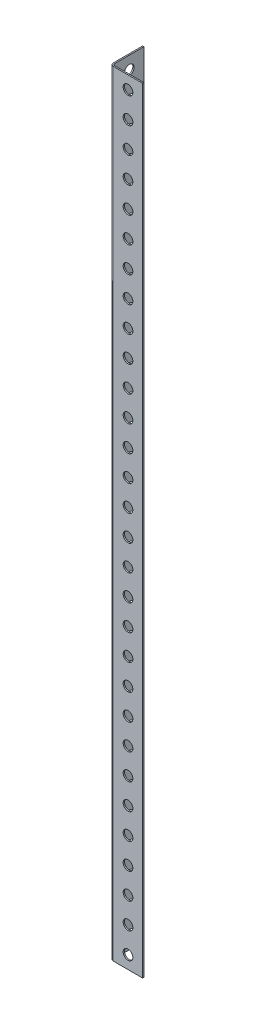
from build123d import *

# Parameters (mm, degrees)
BOSS_EXTRUDE1_DEPTH = 1219.2
SKETCH3_R           = 4.7625
CUT_EXTRUDE1_DEPTH  = 1.27
SKETCH4_R           = 4.7625
CUT_EXTRUDE2_DEPTH  = 1.27
FILLET1_R           = 3.175
FILLET2_R           = 1.5875
CUT_EXTRUDE3_DEPTH  = 457.2


with BuildPart() as part:
    # Sketch1 → Boss-Extrude1 (new body)
    with BuildSketch(Plane(origin=(0, 0, 0), x_dir=(1, 0, 0), z_dir=(0, 1, 0))):
        Polygon((1.27, 1.27), (1.27, 30.48), (1.27, 31.75), (0, 31.75), (0, 0), (31.75, 0), (31.75, 1.27), (30.48, 1.27), align=None)
    extrude(amount=BOSS_EXTRUDE1_DEPTH)

    # Sketch3 → Cut-Extrude1 (cut)
    with BuildSketch(Plane.ZY):
        with Locations((-17.4625, 12.7)):
            Circle(SKETCH3_R)
        with Locations((-17.4625, 38.1)):
            Circle(SKETCH3_R)
        with Locations((-17.4625, 63.5)):
            Circle(SKETCH3_R)
        with Locations((-17.4625, 88.9)):
            Circle(SKETCH3_R)
        with Locations((-17.4625, 114.3)):
            Circle(SKETCH3_R)
        with Locations((-17.4625, 139.7)):
            Circle(SKETCH3_R)
        with Locations((-17.4625, 165.1)):
            Circle(SKETCH3_R)
        with Locations((-17.4625, 190.5)):
            Circle(SKETCH3_R)
        with Locations((-17.4625, 215.9)):
            Circle(SKETCH3_R)
        with Locations((-17.4625, 241.3)):
            Circle(SKETCH3_R)
        with Locations((-17.4625, 266.7)):
            Circle(SKETCH3_R)
        with Locations((-17.4625, 292.1)):
            Circle(SKETCH3_R)
        with Locations((-17.4625, 317.5)):
            Circle(SKETCH3_R)
        with Locations((-17.4625, 342.9)):
            Circle(SKETCH3_R)
        with Locations((-17.4625, 368.3)):
            Circle(SKETCH3_R)
        with Locations((-17.4625, 393.7)):
            Circle(SKETCH3_R)
        with Locations((-17.4625, 419.1)):
            Circle(SKETCH3_R)
        with Locations((-17.4625, 444.5)):
            Circle(SKETCH3_R)
        with Locations((-17.4625, 469.9)):
            Circle(SKETCH3_R)
        with Locations((-17.4625, 495.3)):
            Circle(SKETCH3_R)
        with Locations((-17.4625, 520.7)):
            Circle(SKETCH3_R)
        with Locations((-17.4625, 546.1)):
            Circle(SKETCH3_R)
        with Locations((-17.4625, 571.5)):
            Circle(SKETCH3_R)
        with Locations((-17.4625, 596.9)):
            Circle(SKETCH3_R)
        with Locations((-17.4625, 622.3)):
            Circle(SKETCH3_R)
        with Locations((-17.4625, 647.7)):
            Circle(SKETCH3_R)
        with Locations((-17.4625, 673.1)):
            Circle(SKETCH3_R)
        with Locations((-17.4625, 698.5)):
            Circle(SKETCH3_R)
        with Locations((-17.4625, 723.9)):
            Circle(SKETCH3_R)
        with Locations((-17.4625, 749.3)):
            Circle(SKETCH3_R)
        with Locations((-17.4625, 774.7)):
            Circle(SKETCH3_R)
        with Locations((-17.4625, 800.1)):
            Circle(SKETCH3_R)
        with Locations((-17.4625, 825.5)):
            Circle(SKETCH3_R)
        with Locations((-17.4625, 850.9)):
            Circle(SKETCH3_R)
        with Locations((-17.4625, 876.3)):
            Circle(SKETCH3_R)
        with Locations((-17.4625, 901.7)):
            Circle(SKETCH3_R)
        with Locations((-17.4625, 927.1)):
            Circle(SKETCH3_R)
        with Locations((-17.4625, 952.5)):
            Circle(SKETCH3_R)
        with Locations((-17.4625, 977.9)):
            Circle(SKETCH3_R)
        with Locations((-17.4625, 1003.3)):
            Circle(SKETCH3_R)
        with Locations((-17.4625, 1028.7)):
            Circle(SKETCH3_R)
        with Locations((-17.4625, 1054.1)):
            Circle(SKETCH3_R)
        with Locations((-17.4625, 1079.5)):
            Circle(SKETCH3_R)
        with Locations((-17.4625, 1104.9)):
            Circle(SKETCH3_R)
        with Locations((-17.4625, 1130.3)):
            Circle(SKETCH3_R)
        with Locations((-17.4625, 1155.7)):
            Circle(SKETCH3_R)
        with Locations((-17.4625, 1181.1)):
            Circle(SKETCH3_R)
        with Locations((-17.4625, 1206.5)):
            Circle(SKETCH3_R)
    extrude(amount=-CUT_EXTRUDE1_DEPTH, mode=Mode.SUBTRACT)

    # Sketch4 → Cut-Extrude2 (cut)
    with BuildSketch(Plane.XY):
        with Locations((17.4625, 1206.5)):
            Circle(SKETCH4_R)
        with Locations((17.4625, 1181.1)):
            Circle(SKETCH4_R)
        with Locations((17.4625, 1155.7)):
            Circle(SKETCH4_R)
        with Locations((17.4625, 1130.3)):
            Circle(SKETCH4_R)
        with Locations((17.4625, 1104.9)):
            Circle(SKETCH4_R)
        with Locations((17.4625, 1079.5)):
            Circle(SKETCH4_R)
        with Locations((17.4625, 1054.1)):
            Circle(SKETCH4_R)
        with Locations((17.4625, 1028.7)):
            Circle(SKETCH4_R)
        with Locations((17.4625, 1003.3)):
            Circle(SKETCH4_R)
        with Locations((17.4625, 977.9)):
            Circle(SKETCH4_R)
        with Locations((17.4625, 952.5)):
            Circle(SKETCH4_R)
        with Locations((17.4625, 927.1)):
            Circle(SKETCH4_R)
        with Locations((17.4625, 901.7)):
            Circle(SKETCH4_R)
        with Locations((17.4625, 876.3)):
            Circle(SKETCH4_R)
        with Locations((17.4625, 850.9)):
            Circle(SKETCH4_R)
        with Locations((17.4625, 825.5)):
            Circle(SKETCH4_R)
        with Locations((17.4625, 800.1)):
            Circle(SKETCH4_R)
        with Locations((17.4625, 774.7)):
            Circle(SKETCH4_R)
        with Locations((17.4625, 749.3)):
            Circle(SKETCH4_R)
        with Locations((17.4625, 723.9)):
            Circle(SKETCH4_R)
        with Locations((17.4625, 698.5)):
            Circle(SKETCH4_R)
        with Locations((17.4625, 673.1)):
            Circle(SKETCH4_R)
        with Locations((17.4625, 647.7)):
            Circle(SKETCH4_R)
        with Locations((17.4625, 622.3)):
            Circle(SKETCH4_R)
        with Locations((17.4625, 596.9)):
            Circle(SKETCH4_R)
        with Locations((17.4625, 571.5)):
            Circle(SKETCH4_R)
        with Locations((17.4625, 546.1)):
            Circle(SKETCH4_R)
        with Locations((17.4625, 520.7)):
            Circle(SKETCH4_R)
        with Locations((17.4625, 495.3)):
            Circle(SKETCH4_R)
        with Locations((17.4625, 469.9)):
            Circle(SKETCH4_R)
        with Locations((17.4625, 444.5)):
            Circle(SKETCH4_R)
        with Locations((17.4625, 419.1)):
            Circle(SKETCH4_R)
        with Locations((17.4625, 393.7)):
            Circle(SKETCH4_R)
        with Locations((17.4625, 368.3)):
            Circle(SKETCH4_R)
        with Locations((17.4625, 342.9)):
            Circle(SKETCH4_R)
        with Locations((17.4625, 317.5)):
            Circle(SKETCH4_R)
        with Locations((17.4625, 292.1)):
            Circle(SKETCH4_R)
        with Locations((17.4625, 266.7)):
            Circle(SKETCH4_R)
        with Locations((17.4625, 241.3)):
            Circle(SKETCH4_R)
        with Locations((17.4625, 215.9)):
            Circle(SKETCH4_R)
        with Locations((17.4625, 190.5)):
            Circle(SKETCH4_R)
        with Locations((17.4625, 165.1)):
            Circle(SKETCH4_R)
        with Locations((17.4625, 139.7)):
            Circle(SKETCH4_R)
        with Locations((17.4625, 114.3)):
            Circle(SKETCH4_R)
        with Locations((17.4625, 88.9)):
            Circle(SKETCH4_R)
        with Locations((17.4625, 63.5)):
            Circle(SKETCH4_R)
        with Locations((17.4625, 38.1)):
            Circle(SKETCH4_R)
        with Locations((17.4625, 12.7)):
            Circle(SKETCH4_R)
    extrude(amount=-CUT_EXTRUDE2_DEPTH, mode=Mode.SUBTRACT)

    # Fillet1
    fillet1_edges = [part.edges().sort_by_distance(p)[0] for p in [
        (0, 609.6, 0),
    ]]
    fillet(fillet1_edges, radius=FILLET1_R)

    # Fillet2
    fillet2_edges = [part.edges().sort_by_distance(p)[0] for p in [
        (1.27, 609.6, -1.27),
    ]]
    fillet(fillet2_edges, radius=FILLET2_R)

    # Sketch5 → Cut-Extrude3 (cut)
    with BuildSketch(Plane(origin=(0, 1219.2, 0), x_dir=(1, 0, 0), z_dir=(0, 1, 0))):
        with BuildLine():
            Line((0, 31.75), (0, 3.175))
            ThreePointArc((0, 3.175), (0.92993597, 0.92993597), (3.175, 0))
            Line((3.175, 0), (31.75, 0))
            Line((31.75, 0), (31.75, 1.27))
            Line((31.75, 1.27), (2.8575, 1.27))
            ThreePointArc((2.8575, 1.27), (1.734967985, 1.734967985), (1.27, 2.8575))
            Line((1.27, 2.8575), (1.27, 31.75))
            Line((1.27, 31.75), (0, 31.75))
        make_face()
    extrude(amount=-CUT_EXTRUDE3_DEPTH, mode=Mode.SUBTRACT)


solid = part.part
